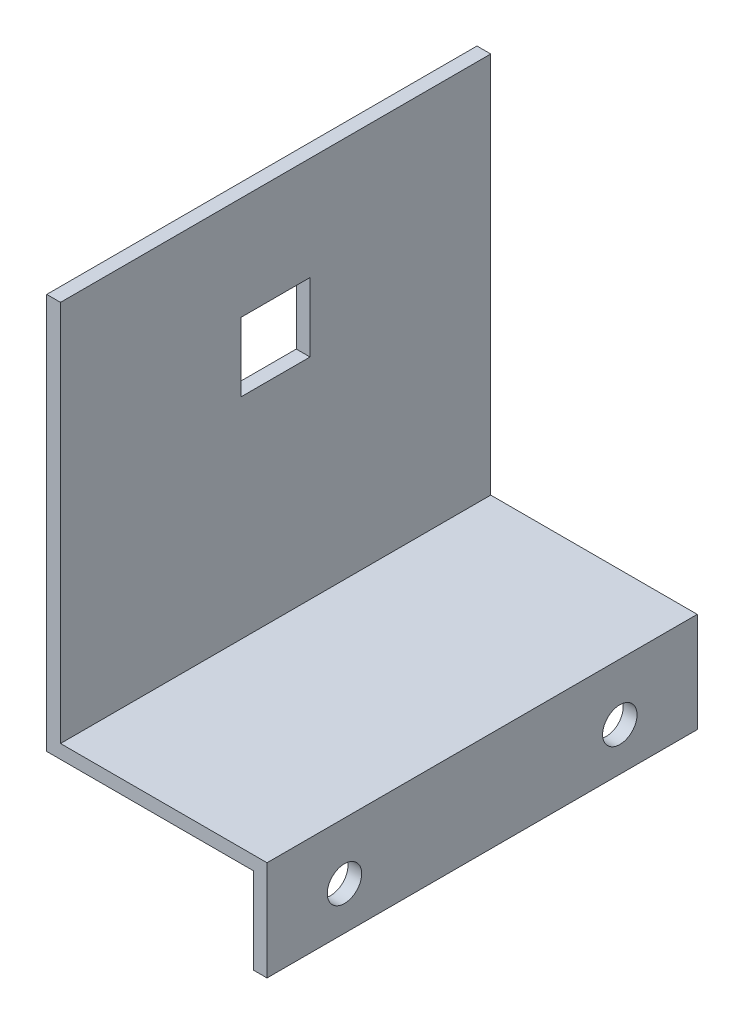
from build123d import *

# Parameters (mm, degrees)
BOSS_EXTRUDE1_DEPTH = 63.5
CUT_EXTRUDE1_DEPTH  = 92.510528356
SKETCH4_R           = 2.54
CUT_EXTRUDE2_DEPTH  = 92.510528356


with BuildPart() as part:
    # Sketch1 → Boss-Extrude1 (new body)
    with BuildSketch(Plane.XY):
        Polygon((0, 0), (30.48, 0), (30.48, -12.7), (32.512, -12.7), (32.512, 2.032), (2.032, 2.032), (2.032, 58.42), (0, 58.42), align=None)
    extrude(amount=-BOSS_EXTRUDE1_DEPTH)

    # Sketch2 → Cut-Extrude1 (cut, through all)
    with BuildSketch(Plane(origin=(2.032, 0, 0), x_dir=(0, 0, -1), z_dir=(1, 0, 0))):
        Polygon((31.75, 43.18), (36.83, 43.18), (36.83, 33.02), (26.67, 33.02), (26.67, 43.18), align=None)
    extrude(amount=-CUT_EXTRUDE1_DEPTH, mode=Mode.SUBTRACT)

    # Sketch4 → Cut-Extrude2 (cut, through all)
    with BuildSketch(Plane.ZY.offset(-30.48)):
        with Locations((-52.07, -6.35)):
            Circle(SKETCH4_R)
        with Locations(Location((-11.43, -6.35, 0), (0, 0, 180))):
            Circle(SKETCH4_R)
    extrude(amount=-CUT_EXTRUDE2_DEPTH, mode=Mode.SUBTRACT)


solid = part.part
